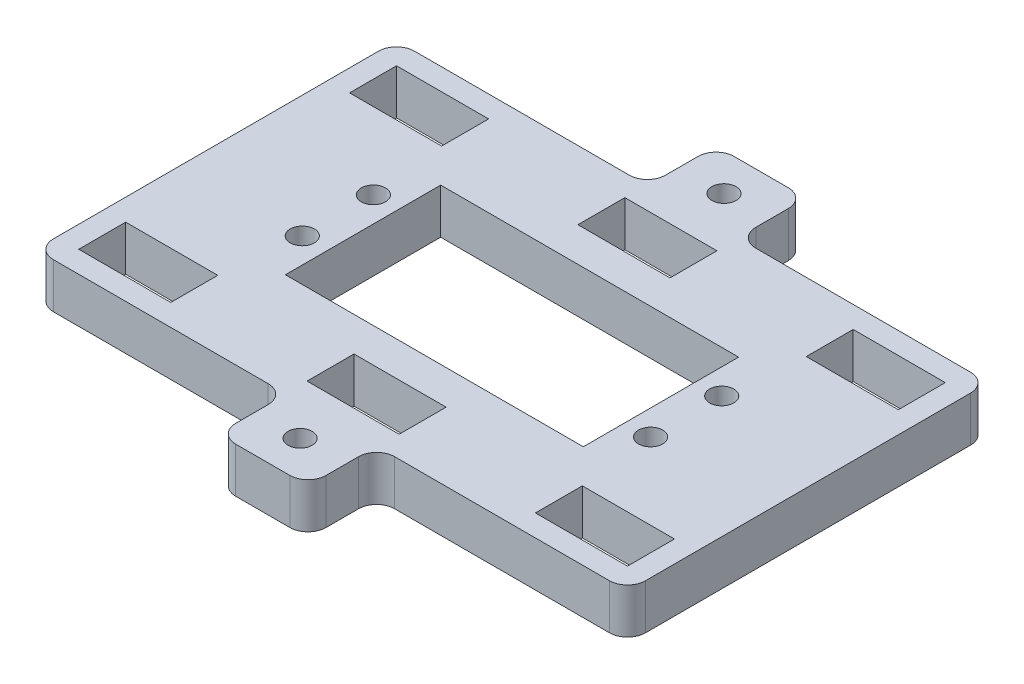
from build123d import *

# Parameters (mm, degrees)
SKETCH1_R           = 1.70053
SKETCH1_W           = 41.91
SKETCH1_H           = 21.844
SKETCH1_W_2         = 12.954
SKETCH1_H_2         = 6.604
BOSS_EXTRUDE1_DEPTH = 6.35
FILLET2_R           = 2.54


with BuildPart() as part:
    # Sketch1 → Boss-Extrude1 (new body)
    with BuildSketch(Plane(origin=(0, 0, 0), x_dir=(1, 0, 0), z_dir=(0, 1, 0))):
        Polygon((41.64584, -25.4), (41.64584, 25.4), (6.35, 25.4), (6.35, 35.052), (-6.35, 35.052), (-6.35, 25.4), (-41.64584, 25.4), (-41.64584, -25.4), (-6.35, -25.4), (-6.35, -35.052), (6.35, -35.052), (6.35, -25.4), align=None)
        with Locations(Location((-24.49957, 5, 0), (0, 0, 270))):
            Circle(SKETCH1_R, mode=Mode.SUBTRACT)
        with Locations(Location((-24.49957, -5, 0), (0, 0, 270))):
            Circle(SKETCH1_R, mode=Mode.SUBTRACT)
        with Locations(Location((24.49957, -5, 0), (0, 0, 270))):
            Circle(SKETCH1_R, mode=Mode.SUBTRACT)
        with Locations(Location((24.49957, 5, 0), (0, 0, 270))):
            Circle(SKETCH1_R, mode=Mode.SUBTRACT)
        with Locations(Location((0, -29.81452, 0), (0, 0, 270))):
            Circle(SKETCH1_R, mode=Mode.SUBTRACT)
        with Locations(Location((0, 29.81452, 0), (0, 0, 90))):
            Circle(SKETCH1_R, mode=Mode.SUBTRACT)
        Rectangle(SKETCH1_W, SKETCH1_H, mode=Mode.SUBTRACT)
        with Locations((-32.12084, 19.05)):
            Rectangle(SKETCH1_W_2, SKETCH1_H_2, mode=Mode.SUBTRACT)
        with Locations((0, 19.05)):
            Rectangle(SKETCH1_W_2, SKETCH1_H_2, mode=Mode.SUBTRACT)
        with Locations((32.12084, 19.05)):
            Rectangle(SKETCH1_W_2, SKETCH1_H_2, mode=Mode.SUBTRACT)
        with Locations((32.12084, -19.05)):
            Rectangle(SKETCH1_W_2, SKETCH1_H_2, mode=Mode.SUBTRACT)
        with Locations((0, -19.05)):
            Rectangle(SKETCH1_W_2, SKETCH1_H_2, mode=Mode.SUBTRACT)
        with Locations((-32.12084, -19.05)):
            Rectangle(SKETCH1_W_2, SKETCH1_H_2, mode=Mode.SUBTRACT)
    extrude(amount=BOSS_EXTRUDE1_DEPTH)

    # Fillet2
    fillet2_edges = [part.edges().sort_by_distance(p)[0] for p in [
        (-6.35, 3.175, -25.4),
        (-6.35, 3.175, -35.052),
        (6.35, 3.175, -35.052),
        (6.35, 3.175, -25.4),
        (41.64584, 3.175, -25.4),
        (41.64584, 3.175, 25.4),
        (6.35, 3.175, 25.4),
        (6.35, 3.175, 35.052),
        (-6.35, 3.175, 35.052),
        (-6.35, 3.175, 25.4),
        (-41.64584, 3.175, 25.4),
        (-41.64584, 3.175, -25.4),
    ]]
    fillet(fillet2_edges, radius=FILLET2_R)


solid = part.part
